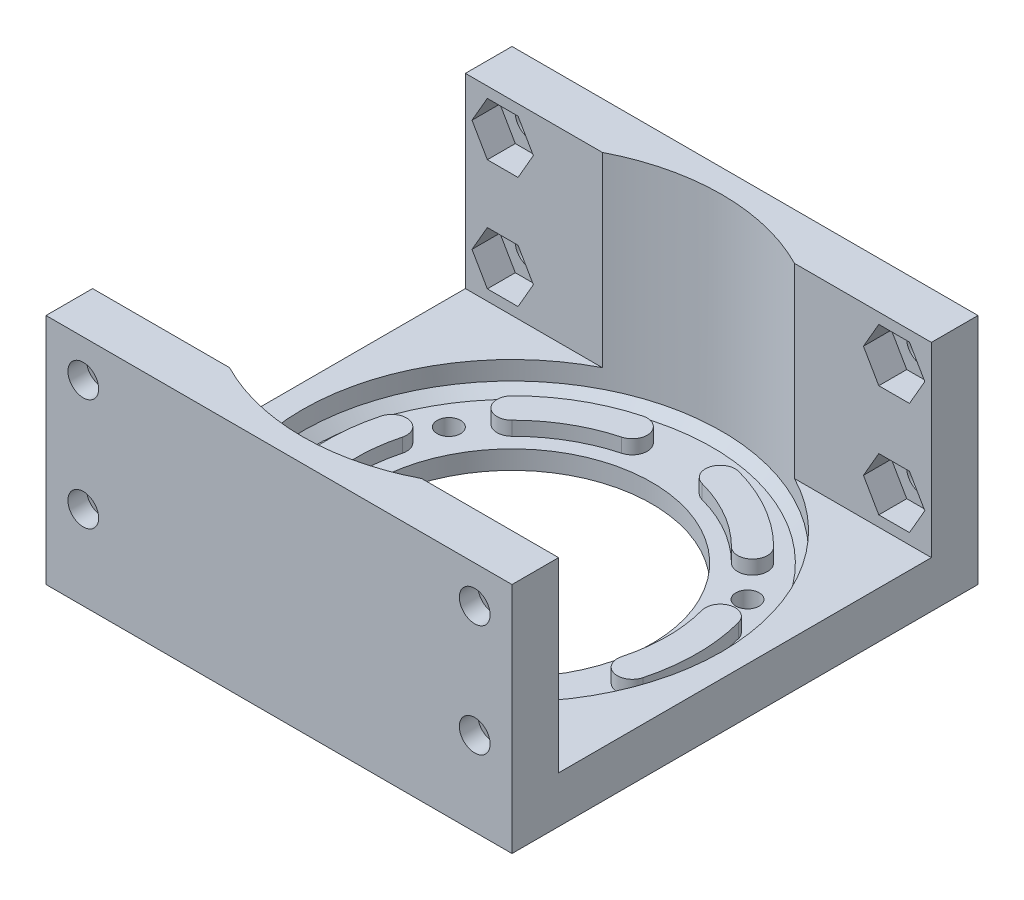
from build123d import *

# Parameters (mm, degrees)
SKETCH_1_W               = 50
SKETCH_1_H               = 50
EXTRUDE_1_DEPTH          = 5
CUT_EXTRUDE_1_REACH      = 37.707
SKETCH_2_R               = 15
SKETCH_3_R               = 22.5
CUT_EXTRUDE_2_DEPTH      = 3
CUT_EXTRUDE_3_REACH      = 37.482
SKETCH_4_R               = 1.25
CHAMFER_1_SIZE           = 1
EXTRUDE_2_DEPTH          = 1.5
EXTRUDE_START            = 20
EXTRUDE_3_DEPTH          = 20
CUT_EXTRUDE_4_REACH      = 59.228
SKETCH_9_R               = 1.65
CUT_EXTRUDE_5_DEPTH      = 3
MIRROR_1_COPY_1_REACH    = 59.228
MIRROR_1_COPY_1_SKETCH_R = 1.65
MIRROR_1_COPY_2_DEPTH    = 3


with BuildPart() as part:
    # 草图1 → 凸台-拉伸1 (new body)
    with BuildSketch(Plane(origin=(0, 0, 0), x_dir=(1, 0, 0), z_dir=(0, 1, 0))):
        Rectangle(SKETCH_1_W, SKETCH_1_H)
    extrude(amount=EXTRUDE_1_DEPTH)

    # 草图2 → 切除-拉伸1 (cut, up to next)
    with BuildSketch(Plane(origin=(0, 5, 0), x_dir=(1, 0, 0), z_dir=(0, 1, 0)), mode=Mode.PRIVATE) as cut_extrude_1_sk1:
        with Locations(Location((0, 0, 0), (0, 0, 270))):
            Circle(SKETCH_2_R)
    cut_extrude_1_tool1 = extrude(cut_extrude_1_sk1.sketch, amount=-CUT_EXTRUDE_1_REACH, mode=Mode.PRIVATE) & part.part
    add(cut_extrude_1_tool1.solids().sort_by_distance((0, 5, 0))[0], mode=Mode.SUBTRACT)

    # 草图3 → 切除-拉伸2 (cut)
    with BuildSketch(Plane(origin=(0, 5, 0), x_dir=(1, 0, 0), z_dir=(0, 1, 0))):
        with Locations(Location((0, 0, 0), (0, 0, 270))):
            Circle(SKETCH_3_R)
    extrude(amount=-CUT_EXTRUDE_2_DEPTH, mode=Mode.SUBTRACT)

    # 草图4 → 切除-拉伸3 (cut, up to next)
    with BuildSketch(Plane(origin=(0, 2, 0), x_dir=(1, 0, 0), z_dir=(0, 1, 0)), mode=Mode.PRIVATE) as cut_extrude_3_sk1:
        with Locations(Location((0, -18.5, 0), (0, 0, 270))):
            Circle(SKETCH_4_R)
    cut_extrude_3_tool1 = extrude(cut_extrude_3_sk1.sketch, amount=-CUT_EXTRUDE_3_REACH, mode=Mode.PRIVATE) & part.part
    # 草图4 → 切除-拉伸3 (cut, up to next)
    with BuildSketch(Plane(origin=(0, 2, 0), x_dir=(1, 0, 0), z_dir=(0, 1, 0)), mode=Mode.PRIVATE) as cut_extrude_3_sk2:
        with Locations(Location((-16.02146997, 9.25, 0), (0, 0, 270))):
            Circle(SKETCH_4_R)
    cut_extrude_3_tool2 = extrude(cut_extrude_3_sk2.sketch, amount=-CUT_EXTRUDE_3_REACH, mode=Mode.PRIVATE) & part.part
    # 草图4 → 切除-拉伸3 (cut, up to next)
    with BuildSketch(Plane(origin=(0, 2, 0), x_dir=(1, 0, 0), z_dir=(0, 1, 0)), mode=Mode.PRIVATE) as cut_extrude_3_sk3:
        with Locations(Location((16.02146997, 9.25, 0), (0, 0, 270))):
            Circle(SKETCH_4_R)
    cut_extrude_3_tool3 = extrude(cut_extrude_3_sk3.sketch, amount=-CUT_EXTRUDE_3_REACH, mode=Mode.PRIVATE) & part.part
    add(cut_extrude_3_tool1.solids().sort_by_distance((0, 2, 18.5))[0], mode=Mode.SUBTRACT)
    add(cut_extrude_3_tool2.solids().sort_by_distance((-16.02147, 2, -9.25))[0], mode=Mode.SUBTRACT)
    add(cut_extrude_3_tool3.solids().sort_by_distance((16.02147, 2, -9.25))[0], mode=Mode.SUBTRACT)

    # 倒角1
    chamfer_1_edges = [part.edges().sort_by_distance(p)[0] for p in [
        (0, 2, -22.5),
    ]]
    chamfer(chamfer_1_edges, length=CHAMFER_1_SIZE)

    # 草图7 → 凸台-拉伸2 (add)
    with BuildSketch(Plane(origin=(0, 2, 0), x_dir=(1, 0, 0), z_dir=(0, 1, 0))):
        with BuildLine():
            ThreePointArc((-5.137558045, 19.173627652), (-9.925, 17.190604265), (-14.036069607, 14.036069607))
            ThreePointArc((-14.036069607, 14.036069607), (-14.036069607, 11.773327907), (-11.773327907, 11.773327907))
            ThreePointArc((-11.773327907, 11.773327907), (-8.325, 14.419322973), (-4.309337101, 16.082665008))
            ThreePointArc((-4.309337101, 16.082665008), (-3.177966251, 18.042256802), (-5.137558045, 19.173627652))
        make_face()
        with BuildLine():
            ThreePointArc((14.036069607, 14.036069607), (9.925, 17.190604265), (5.137558045, 19.173627652))
            ThreePointArc((5.137558045, 19.173627652), (3.177966251, 18.042256802), (4.309337101, 16.082665008))
            ThreePointArc((4.309337101, 16.082665008), (8.325, 14.419322973), (11.773327907, 11.773327907))
            ThreePointArc((11.773327907, 11.773327907), (14.036069607, 11.773327907), (14.036069607, 14.036069607))
        make_face()
        with BuildLine():
            ThreePointArc((19.173627652, -5.137558045), (19.85, 0), (19.173627652, 5.137558045))
            ThreePointArc((19.173627652, 5.137558045), (17.214035858, 6.268928895), (16.082665008, 4.309337101))
            ThreePointArc((16.082665008, 4.309337101), (16.65, 0), (16.082665008, -4.309337101))
            ThreePointArc((16.082665008, -4.309337101), (17.214035858, -6.268928895), (19.173627652, -5.137558045))
        make_face()
        with BuildLine():
            ThreePointArc((5.137558045, -19.173627652), (9.925, -17.190604265), (14.036069607, -14.036069607))
            ThreePointArc((14.036069607, -14.036069607), (14.036069607, -11.773327907), (11.773327907, -11.773327907))
            ThreePointArc((11.773327907, -11.773327907), (8.325, -14.419322973), (4.309337101, -16.082665008))
            ThreePointArc((4.309337101, -16.082665008), (3.177966251, -18.042256802), (5.137558045, -19.173627652))
        make_face()
        with BuildLine():
            ThreePointArc((-14.036069607, -14.036069607), (-9.925, -17.190604265), (-5.137558045, -19.173627652))
            ThreePointArc((-5.137558045, -19.173627652), (-3.177966251, -18.042256802), (-4.309337101, -16.082665008))
            ThreePointArc((-4.309337101, -16.082665008), (-8.325, -14.419322973), (-11.773327907, -11.773327907))
            ThreePointArc((-11.773327907, -11.773327907), (-14.036069607, -11.773327907), (-14.036069607, -14.036069607))
        make_face()
        with BuildLine():
            ThreePointArc((-19.173627652, 5.137558045), (-19.85, 0), (-19.173627652, -5.137558045))
            ThreePointArc((-19.173627652, -5.137558045), (-17.214035858, -6.268928895), (-16.082665008, -4.309337101))
            ThreePointArc((-16.082665008, -4.309337101), (-16.65, 0), (-16.082665008, 4.309337101))
            ThreePointArc((-16.082665008, 4.309337101), (-17.214035858, 6.268928895), (-19.173627652, 5.137558045))
        make_face()
    extrude(amount=EXTRUDE_2_DEPTH)

    # 草图8 → 凸台-拉伸3 (add)
    with BuildSketch(Plane(origin=(0, 5, 0), x_dir=(1, 0, 0), z_dir=(0, 1, 0)).offset(EXTRUDE_START)):
        with BuildLine():
            Line((-25, -25), (25, -25))
            Line((25, -25), (25, -20))
            Line((25, -20), (10.307764064, -20))
            ThreePointArc((10.307764064, -20), (0, -22.5), (-10.307764064, -20))
            Line((-10.307764064, -20), (-25, -20))
            Line((-25, -20), (-25, -25))
        make_face()
    extrude_3 = extrude(amount=-EXTRUDE_3_DEPTH)

    # 草图9 → 切除-拉伸4 (cut, up to next)
    with BuildSketch(Plane(origin=(0, 0, 20), x_dir=(-1, 0, 0), z_dir=(0, 0, -1)), mode=Mode.PRIVATE) as cut_extrude_4_sk1:
        with Locations((21, 21)):
            Circle(SKETCH_9_R)
    cut_extrude_4_tool1 = extrude(cut_extrude_4_sk1.sketch, amount=-CUT_EXTRUDE_4_REACH, mode=Mode.PRIVATE) & part.part
    # 草图9 → 切除-拉伸4 (cut, up to next)
    with BuildSketch(Plane(origin=(0, 0, 20), x_dir=(-1, 0, 0), z_dir=(0, 0, -1)), mode=Mode.PRIVATE) as cut_extrude_4_sk2:
        with Locations((21, 9)):
            Circle(SKETCH_9_R)
    cut_extrude_4_tool2 = extrude(cut_extrude_4_sk2.sketch, amount=-CUT_EXTRUDE_4_REACH, mode=Mode.PRIVATE) & part.part
    cut_extrude_4_1 = cut_extrude_4_tool1.solids().sort_by_distance((-21, 21, 20))[0]
    add(cut_extrude_4_1, mode=Mode.SUBTRACT)
    cut_extrude_4_2 = cut_extrude_4_tool2.solids().sort_by_distance((-21, 9, 20))[0]
    add(cut_extrude_4_2, mode=Mode.SUBTRACT)
    cut_extrude_4 = cut_extrude_4_1 + cut_extrude_4_2  # 切除-拉伸4 as one shape, for the pattern or mirror that repeats it

    # 草图10 → 切除-拉伸5 (cut)
    with BuildSketch(Plane(origin=(0, 0, 20), x_dir=(-1, 0, 0), z_dir=(0, 0, -1))):
        Polygon((24.290896534, 21), (22.645448267, 23.85), (19.354551733, 23.85), (17.709103466, 21), (19.354551733, 18.15), (22.645448267, 18.15), align=None)
        Polygon((24.290896534, 9), (22.645448267, 11.85), (19.354551733, 11.85), (17.709103466, 9), (19.354551733, 6.15), (22.645448267, 6.15), align=None)
    cut_extrude_5 = extrude(amount=-CUT_EXTRUDE_5_DEPTH, mode=Mode.SUBTRACT)

    # 镜向2: 切除-拉伸4, 切除-拉伸5 across plane
    add(cut_extrude_4.mirror(Plane(origin=(0, 0, 0), x_dir=(0, 0, 1), z_dir=(1, 0, 0))), mode=Mode.SUBTRACT)
    add(cut_extrude_5.mirror(Plane(origin=(0, 0, 0), x_dir=(0, 0, 1), z_dir=(1, 0, 0))), mode=Mode.SUBTRACT)

    # 镜向1: 凸台-拉伸3, 切除-拉伸4, 切除-拉伸5 across plane
    add(extrude_3.mirror(Plane.XY))
    add(cut_extrude_4.mirror(Plane.XY), mode=Mode.SUBTRACT)
    add(cut_extrude_5.mirror(Plane.XY), mode=Mode.SUBTRACT)

    # 镜向1 copy 1 sketch → 镜向1 copy 1 (cut, up to next)
    with BuildSketch(Plane.XY.offset(-20), mode=Mode.PRIVATE) as mirror_1_copy_1_sk1:
        with Locations((21, 21)):
            Circle(MIRROR_1_COPY_1_SKETCH_R)
    mirror_1_copy_1_tool1 = extrude(mirror_1_copy_1_sk1.sketch, amount=-MIRROR_1_COPY_1_REACH, mode=Mode.PRIVATE) & part.part
    # 镜向1 copy 1 sketch → 镜向1 copy 1 (cut, up to next)
    with BuildSketch(Plane.XY.offset(-20), mode=Mode.PRIVATE) as mirror_1_copy_1_sk2:
        with Locations((21, 9)):
            Circle(MIRROR_1_COPY_1_SKETCH_R)
    mirror_1_copy_1_tool2 = extrude(mirror_1_copy_1_sk2.sketch, amount=-MIRROR_1_COPY_1_REACH, mode=Mode.PRIVATE) & part.part
    add(mirror_1_copy_1_tool1.solids().sort_by_distance((21, 21, -20))[0], mode=Mode.SUBTRACT)
    add(mirror_1_copy_1_tool2.solids().sort_by_distance((21, 9, -20))[0], mode=Mode.SUBTRACT)

    # 镜向1 copy 2 sketch → 镜向1 copy 2 (cut)
    with BuildSketch(Plane.XY.offset(-20)):
        Polygon((24.290896534, 21), (22.645448267, 23.85), (19.354551733, 23.85), (17.709103466, 21), (19.354551733, 18.15), (22.645448267, 18.15), align=None)
        Polygon((24.290896534, 9), (22.645448267, 11.85), (19.354551733, 11.85), (17.709103466, 9), (19.354551733, 6.15), (22.645448267, 6.15), align=None)
    extrude(amount=-MIRROR_1_COPY_2_DEPTH, mode=Mode.SUBTRACT)


solid = part.part
